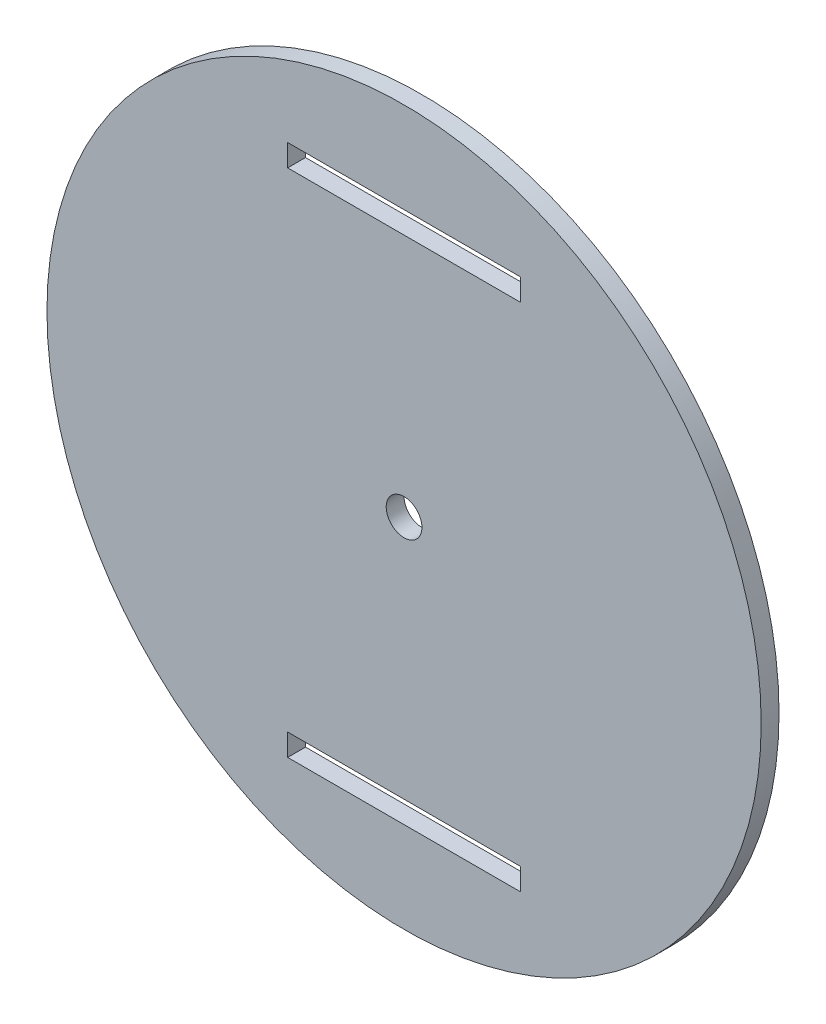
from build123d import *

# Parameters (mm, degrees)
SKETCH1_R           = 20
BOSS_EXTRUDE1_DEPTH = 1
SKETCH2_W           = 13.037346626
SKETCH2_H           = 1.230994102
CUT_EXTRUDE1_DEPTH  = 1
SKETCH3_R           = 1
CUT_EXTRUDE2_DEPTH  = 1


with BuildPart() as part:
    # Sketch1 → Boss-Extrude1 (new body)
    with BuildSketch(Plane.XY):
        Circle(SKETCH1_R)
    extrude(amount=BOSS_EXTRUDE1_DEPTH)

    # Sketch2 → Cut-Extrude1 (cut)
    with BuildSketch(Plane.XY.offset(1)):
        with Locations((0, -14.296317866)):
            Rectangle(SKETCH2_W, SKETCH2_H)
        with Locations((0, 14.296317866)):
            Rectangle(SKETCH2_W, SKETCH2_H)
    extrude(amount=-CUT_EXTRUDE1_DEPTH, mode=Mode.SUBTRACT)

    # Sketch3 → Cut-Extrude2 (cut)
    with BuildSketch(Plane.XY.offset(1)):
        Circle(SKETCH3_R)
    extrude(amount=-CUT_EXTRUDE2_DEPTH, mode=Mode.SUBTRACT)


solid = part.part
